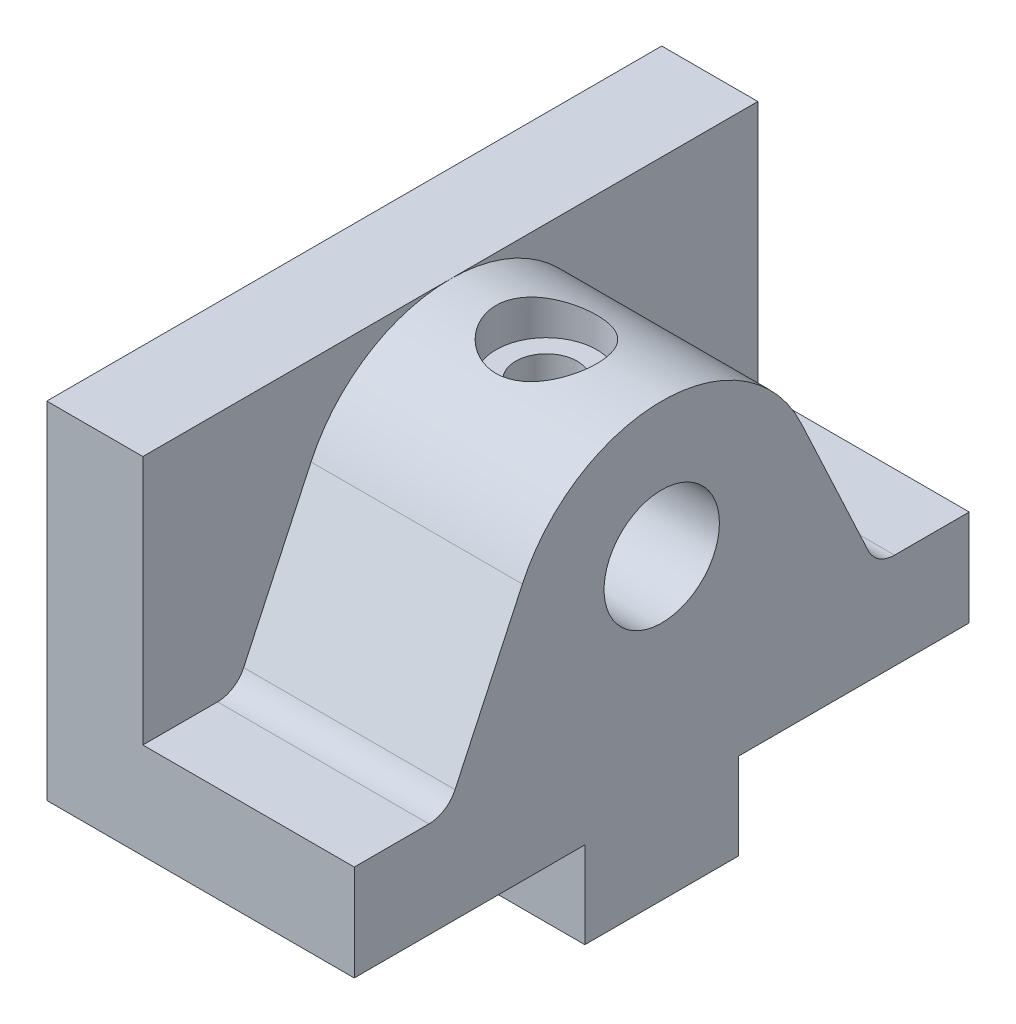
from build123d import *

# Parameters (mm, degrees)
SKETCH2_R                       = 6
BOSS_EXTRUDE1_DEPTH             = 32
BOSS_EXTRUDE2_DEPTH             = 10
CBORE_FOR_M6_SHCS1_D            = 6.4
CBORE_FOR_M6_SHCS1_DEPTH        = 10
CBORE_FOR_M6_SHCS1_CBORE_D      = 10.5
CBORE_FOR_M6_SHCS1_CBORE_DEPTH  = 4
CBORE_FOR_M6_SHCS1_TIP          = 1.922753981
TAP_DRILL_FOR_M6X1_0_TAP1_D     = 5
TAP_DRILL_FOR_M6X1_0_TAP1_DEPTH = 16
TAP_DRILL_FOR_M6X1_0_TAP1_TIP   = 1.502151548
SKETCH2_6_R                     = 6
BOSS_EXTRUDE3_DEPTH             = 10


with BuildPart() as part:
    # Sketch2 → Boss-Extrude1 (new body)
    with BuildSketch(Plane(origin=(0, 0, 0), x_dir=(0, 0, -1), z_dir=(1, 0, 0))):
        with BuildLine():
            Line((-8, 9), (-8, 0))
            Line((-8, 0), (8, 0))
            Line((8, 0), (8, 9))
            Line((8, 9), (32, 9))
            Line((32, 9), (32, 19))
            Line((32, 19), (24.228334067, 19))
            ThreePointArc((24.228334067, 19), (22.616435242, 19.469825663), (21.509410706, 20.732145215))
            Line((21.509410706, 20.732145215), (14.500924593, 35.761892188))
            ThreePointArc((14.500924593, 35.761892188), (8.596793734, 42.494263133), (0, 45))
            ThreePointArc((0, 45), (-8.596793734, 42.494263133), (-14.500924593, 35.761892188))
            Line((-14.500924593, 35.761892188), (-21.509410706, 20.732145215))
            ThreePointArc((-21.509410706, 20.732145215), (-22.616435242, 19.469825663), (-24.228334067, 19))
            Line((-24.228334067, 19), (-32, 19))
            Line((-32, 19), (-32, 9))
            Line((-32, 9), (-8, 9))
        make_face()
        with Locations((0, 31)):
            Circle(SKETCH2_R, mode=Mode.SUBTRACT)
    extrude(amount=BOSS_EXTRUDE1_DEPTH)

    # Sketch2<5> → Boss-Extrude2 (add)
    with BuildSketch(Plane(origin=(0, 0, 0), x_dir=(0, 0, -1), z_dir=(1, 0, 0))):
        with BuildLine():
            Line((-32, 45), (-32, 19))
            Line((-32, 19), (-24.228334067, 19))
            ThreePointArc((-24.228334067, 19), (-22.616435242, 19.469825663), (-21.509410706, 20.732145215))
            Line((-21.509410706, 20.732145215), (-14.500924593, 35.761892188))
            ThreePointArc((-14.500924593, 35.761892188), (-8.596793734, 42.494263133), (0, 45))
            Line((0, 45), (-32, 45))
        make_face()
        with BuildLine():
            Line((24.228334067, 19), (32, 19))
            Line((32, 19), (32, 45))
            Line((32, 45), (0, 45))
            ThreePointArc((0, 45), (8.596793734, 42.494263133), (14.500924593, 35.761892188))
            Line((14.500924593, 35.761892188), (21.509410706, 20.732145215))
            ThreePointArc((21.509410706, 20.732145215), (22.616435242, 19.469825663), (24.228334067, 19))
        make_face()
    extrude(amount=BOSS_EXTRUDE2_DEPTH)

    # CBORE for M6 SHCS1
    with Locations(Plane(origin=(20, 45, 0), x_dir=(0, 0, 1), z_dir=(0, 1, 0))):
        with Locations((0, 0)):
            CounterBoreHole(CBORE_FOR_M6_SHCS1_D / 2, CBORE_FOR_M6_SHCS1_CBORE_D / 2, CBORE_FOR_M6_SHCS1_CBORE_DEPTH, depth=CBORE_FOR_M6_SHCS1_DEPTH)
            with Locations((0, 0, -(CBORE_FOR_M6_SHCS1_DEPTH + CBORE_FOR_M6_SHCS1_TIP / 2))):  # 118° drill point
                Cone(0, CBORE_FOR_M6_SHCS1_D / 2, CBORE_FOR_M6_SHCS1_TIP, mode=Mode.SUBTRACT)

    # Tap Drill for M6x1.0 Tap1
    with Locations(Plane(origin=(0, 0, 0), x_dir=(-1, 0, 0), z_dir=(0, -1, 0))):
        with Locations((-24, 0), (-8, 0)):
            Hole(TAP_DRILL_FOR_M6X1_0_TAP1_D / 2, depth=TAP_DRILL_FOR_M6X1_0_TAP1_DEPTH)
            with Locations((0, 0, -(TAP_DRILL_FOR_M6X1_0_TAP1_DEPTH + TAP_DRILL_FOR_M6X1_0_TAP1_TIP / 2))):  # 118° drill point
                Cone(0, TAP_DRILL_FOR_M6X1_0_TAP1_D / 2, TAP_DRILL_FOR_M6X1_0_TAP1_TIP, mode=Mode.SUBTRACT)

    # Sketch2<6> → Boss-Extrude3 (add)
    with BuildSketch(Plane(origin=(0, 0, 0), x_dir=(0, 0, -1), z_dir=(1, 0, 0))):
        with Locations((0, 31)):
            Circle(SKETCH2_6_R)
    extrude(amount=BOSS_EXTRUDE3_DEPTH)


solid = part.part
